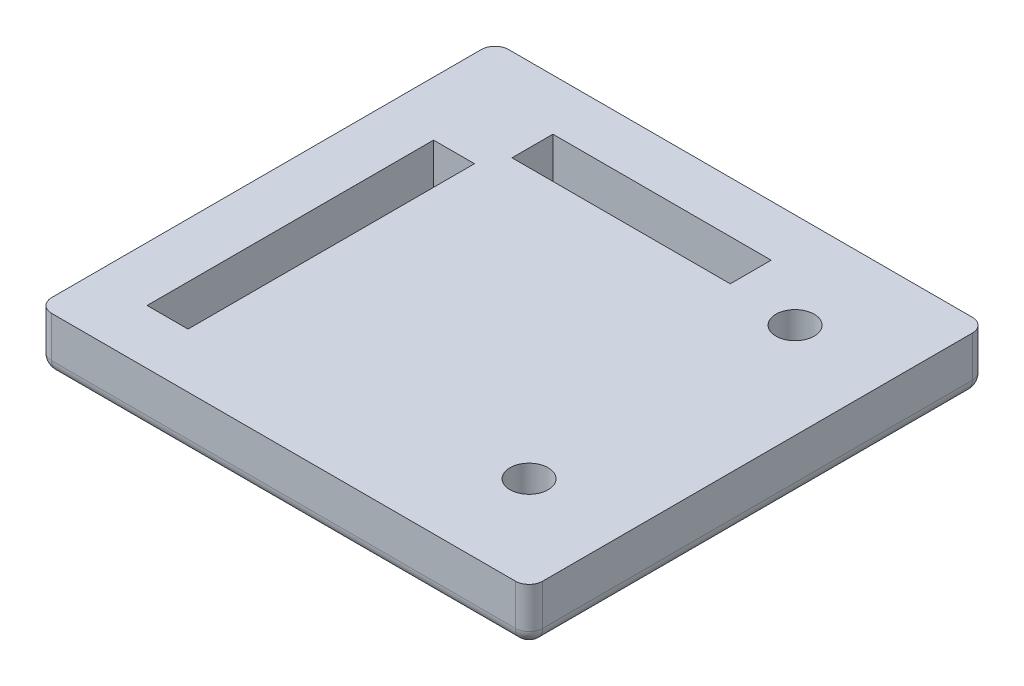
from build123d import *

# Parameters (mm, degrees)
SKETCH1_W            = 36
SKETCH1_H            = 33.5
SKETCH1_R            = 1.4
SKETCH1_W_2          = 3
SKETCH1_H_2          = 21
SKETCH1_W_3          = 16
SKETCH1_H_3          = 3
BASE_DEPTH           = 4
F_1MM_EDGE_FILLETS_R = 1


with BuildPart() as part:
    # Sketch1 → Base (new body)
    with BuildSketch(Plane(origin=(0, 0, 0), x_dir=(1, 0, 0), z_dir=(0, 1, 0))):
        Rectangle(SKETCH1_W, SKETCH1_H)
        with Locations(Location((11, -9.75, 0), (0, 0, 270))):
            Circle(SKETCH1_R, mode=Mode.SUBTRACT)
        with Locations(Location((11, 9.75, 0), (0, 0, 270))):
            Circle(SKETCH1_R, mode=Mode.SUBTRACT)
        with Locations((-12.5, -2.25)):
            Rectangle(SKETCH1_W_2, SKETCH1_H_2, mode=Mode.SUBTRACT)
        with Locations((-2, 11.5)):
            Rectangle(SKETCH1_W_3, SKETCH1_H_3, mode=Mode.SUBTRACT)
    extrude(amount=BASE_DEPTH)

    # 1mm Edge Fillets
    f_1mm_edge_fillets_edges = [part.edges().sort_by_distance(p)[0] for p in [
        (0, 0, 16.75),
        (-18, 0, 0),
        (0, 0, -16.75),
        (18, 0, 0),
        (18, 2, 16.75),
        (-18, 2, 16.75),
        (-18, 2, -16.75),
        (18, 2, -16.75),
    ]]
    fillet(f_1mm_edge_fillets_edges, radius=F_1MM_EDGE_FILLETS_R)


solid = part.part
